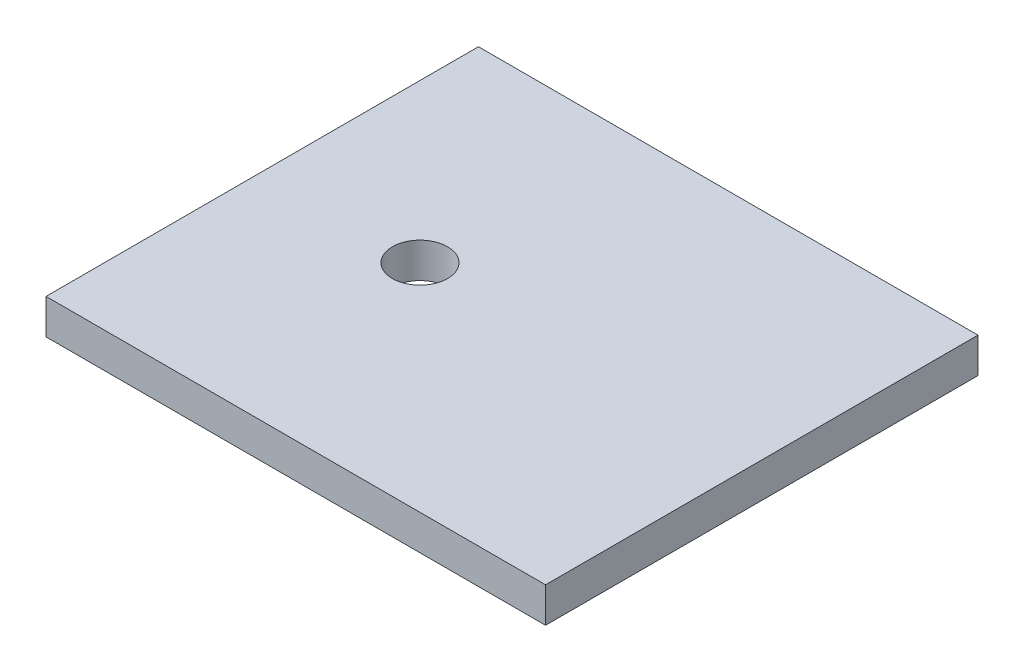
from build123d import *

# Parameters (mm, degrees)
SKETCH2_W           = 171.45
SKETCH2_H           = 235
SKETCH2_R           = 15
BOSS_EXTRUDE3_DEPTH = 19.05
SKETCH3_W           = 235
SKETCH3_H           = 19.05
BOSS_EXTRUDE4_DEPTH = 100


with BuildPart() as part:
    # Sketch2 → Boss-Extrude3 (new body)
    with BuildSketch(Plane(origin=(0, 0, 0), x_dir=(1, 0, 0), z_dir=(0, 1, 0))):
        Rectangle(SKETCH2_W, SKETCH2_H)
        with Locations(Location((0, 0, 0), (0, 0, 90))):
            Circle(SKETCH2_R, mode=Mode.SUBTRACT)
    extrude(amount=BOSS_EXTRUDE3_DEPTH)

    # Sketch3 → Boss-Extrude4 (add)
    with BuildSketch(Plane(origin=(85.725, 0, 0), x_dir=(0, 0, -1), z_dir=(1, 0, 0))):
        with Locations((0, 9.525)):
            Rectangle(SKETCH3_W, SKETCH3_H)
    extrude(amount=BOSS_EXTRUDE4_DEPTH)


solid = part.part
